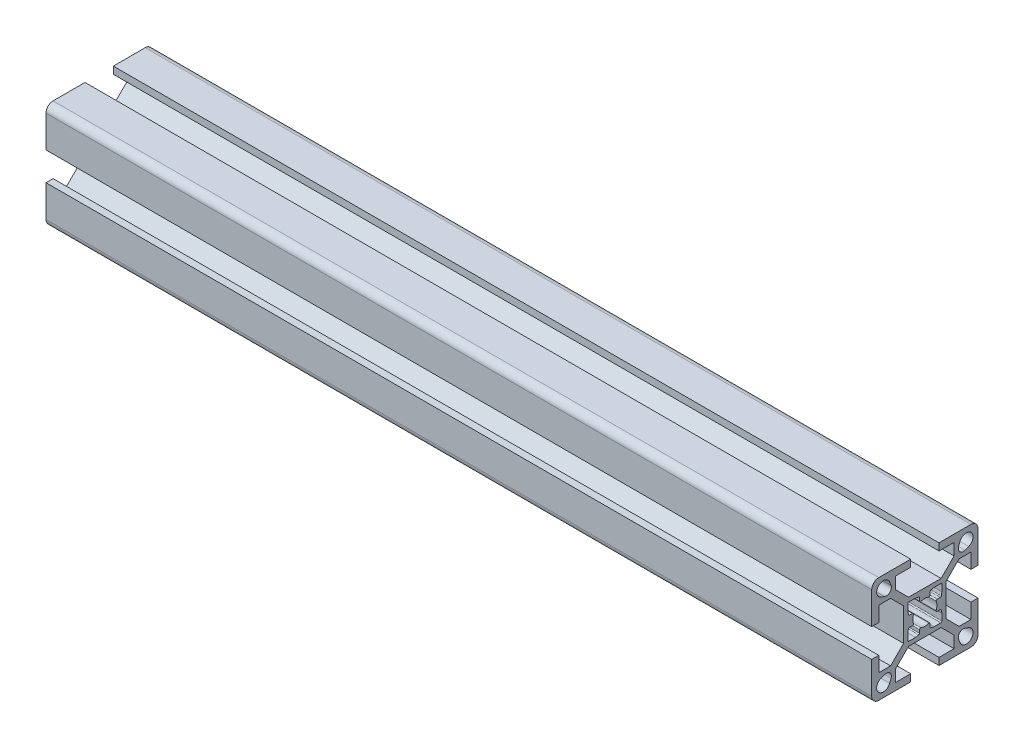
from build123d import *

# Parameters (mm, degrees)
BOSS_EXTRUDE1_DEPTH = 233


with BuildPart() as part:
    # Sketch1 → Boss-Extrude1 (new body)
    with BuildSketch(Plane(origin=(0, 0, 0), x_dir=(0, 0, -1), z_dir=(1, 0, 0))):
        with BuildLine():
            Line((-15, 13), (-15, 4))
            Line((-15, 4), (-13, 4))
            Line((-13, 4), (-13, 8.25))
            Line((-13, 8.25), (-9.664213562, 8.25))
            Line((-9.664213562, 8.25), (-6, 4.585786438))
            Line((-6, 4.585786438), (-6, -4.585786438))
            Line((-6, -4.585786438), (-9.664213562, -8.25))
            Line((-9.664213562, -8.25), (-13, -8.25))
            Line((-13, -8.25), (-13, -4))
            Line((-13, -4), (-15, -4))
            Line((-15, -4), (-15, -13))
            ThreePointArc((-15, -13), (-14.414213562, -14.414213562), (-13, -15))
            Line((-13, -15), (-4, -15))
            Line((-4, -15), (-4, -13))
            Line((-4, -13), (-8.25, -13))
            Line((-8.25, -13), (-8.25, -9.664213562))
            Line((-8.25, -9.664213562), (-4.585786438, -6))
            Line((-4.585786438, -6), (4.585786438, -6))
            Line((4.585786438, -6), (8.25, -9.664213562))
            Line((8.25, -9.664213562), (8.25, -13))
            Line((8.25, -13), (4, -13))
            Line((4, -13), (4, -15))
            Line((4, -15), (13, -15))
            ThreePointArc((13, -15), (14.414213562, -14.414213562), (15, -13))
            Line((15, -13), (15, -4))
            Line((15, -4), (13, -4))
            Line((13, -4), (13, -8.25))
            Line((13, -8.25), (9.664213562, -8.25))
            Line((9.664213562, -8.25), (6, -4.585786438))
            Line((6, -4.585786438), (6, 4.585786438))
            Line((6, 4.585786438), (9.664213562, 8.25))
            Line((9.664213562, 8.25), (13, 8.25))
            Line((13, 8.25), (13, 4))
            Line((13, 4), (15, 4))
            Line((15, 4), (15, 13))
            ThreePointArc((15, 13), (14.414213562, 14.414213562), (13, 15))
            Line((13, 15), (4, 15))
            Line((4, 15), (4, 13))
            Line((4, 13), (8.25, 13))
            Line((8.25, 13), (8.25, 9.664213562))
            Line((8.25, 9.664213562), (4.585786438, 6))
            Line((4.585786438, 6), (-4.585786438, 6))
            Line((-4.585786438, 6), (-8.25, 9.664213562))
            Line((-8.25, 9.664213562), (-8.25, 13))
            Line((-8.25, 13), (-4, 13))
            Line((-4, 13), (-4, 15))
            Line((-4, 15), (-13, 15))
            ThreePointArc((-13, 15), (-14.414213562, 14.414213562), (-15, 13))
        make_face()
        with BuildLine():
            Line((-9.539070071, 11.338915743), (-9.918883282, 12.361530981))
            ThreePointArc((-9.918883282, 12.361530981), (-13.043502884, 13.043502884), (-12.361530981, 9.918883282))
            Line((-12.361530981, 9.918883282), (-11.338915743, 9.539070071))
            ThreePointArc((-11.338915743, 9.539070071), (-9.861522369, 9.861522369), (-9.539070071, 11.338915743))
        make_face(mode=Mode.SUBTRACT)
        with BuildLine():
            Line((9.918883282, 12.361530981), (9.539070071, 11.338915743))
            ThreePointArc((9.539070071, 11.338915743), (9.861522369, 9.861522369), (11.338915743, 9.539070071))
            Line((11.338915743, 9.539070071), (12.361530981, 9.918883282))
            ThreePointArc((12.361530981, 9.918883282), (13.043502884, 13.043502884), (9.918883282, 12.361530981))
        make_face(mode=Mode.SUBTRACT)
        with BuildLine():
            Line((12.361530981, -9.918883282), (11.338915743, -9.539070071))
            ThreePointArc((11.338915743, -9.539070071), (9.861522369, -9.861522369), (9.539070071, -11.338915743))
            Line((9.539070071, -11.338915743), (9.918883282, -12.361530981))
            ThreePointArc((9.918883282, -12.361530981), (13.043502884, -13.043502884), (12.361530981, -9.918883282))
        make_face(mode=Mode.SUBTRACT)
        with BuildLine():
            Line((-11.338915743, -9.539070071), (-12.361530981, -9.918883282))
            ThreePointArc((-12.361530981, -9.918883282), (-13.043502884, -13.043502884), (-9.918883282, -12.361530981))
            Line((-9.918883282, -12.361530981), (-9.539070071, -11.338915743))
            ThreePointArc((-9.539070071, -11.338915743), (-9.861522369, -9.861522369), (-11.338915743, -9.539070071))
        make_face(mode=Mode.SUBTRACT)
        with BuildLine():
            Line((-4.8, -2.644433572), (-4.8, -4.5))
            ThreePointArc((-4.8, -4.5), (-4.712132034, -4.712132034), (-4.5, -4.8))
            Line((-4.5, -4.8), (-2.644433572, -4.8))
            ThreePointArc((-2.644433572, -4.8), (-2.615679847, -4.79861886), (-2.587190874, -4.794488155))
            Line((-2.587190874, -4.794488155), (-1.742757301, -4.630346896))
            ThreePointArc((-1.742757301, -4.630346896), (-1.568512625, -4.526682207), (-1.5, -4.335858741))
            Line((-1.5, -4.335858741), (-1.5, -3.5))
            ThreePointArc((-1.5, -3.5), (-1.374371458, -3.255879959), (-1.102702703, -3.216216216))
            ThreePointArc((-1.102702703, -3.216216216), (0, -3.4), (1.102702703, -3.216216216))
            ThreePointArc((1.102702703, -3.216216216), (1.374371458, -3.255879959), (1.5, -3.5))
            Line((1.5, -3.5), (1.5, -4.335858741))
            ThreePointArc((1.5, -4.335858741), (1.568512625, -4.526682207), (1.742757301, -4.630346896))
            Line((1.742757301, -4.630346896), (2.587190874, -4.794488155))
            ThreePointArc((2.587190874, -4.794488155), (2.615679847, -4.79861886), (2.644433572, -4.8))
            Line((2.644433572, -4.8), (4.5, -4.8))
            ThreePointArc((4.5, -4.8), (4.712132034, -4.712132034), (4.8, -4.5))
            Line((4.8, -4.5), (4.8, -2.644433572))
            ThreePointArc((4.8, -2.644433572), (4.79861886, -2.615679847), (4.794488155, -2.587190874))
            Line((4.794488155, -2.587190874), (4.630346896, -1.742757301))
            ThreePointArc((4.630346896, -1.742757301), (4.526682207, -1.568512625), (4.335858741, -1.5))
            Line((4.335858741, -1.5), (3.5, -1.5))
            ThreePointArc((3.5, -1.5), (3.255879959, -1.374371458), (3.216216216, -1.102702703))
            ThreePointArc((3.216216216, -1.102702703), (3.4, 0), (3.216216216, 1.102702703))
            ThreePointArc((3.216216216, 1.102702703), (3.255879959, 1.374371458), (3.5, 1.5))
            Line((3.5, 1.5), (4.335858741, 1.5))
            ThreePointArc((4.335858741, 1.5), (4.526682207, 1.568512625), (4.630346896, 1.742757301))
            Line((4.630346896, 1.742757301), (4.794488155, 2.587190874))
            ThreePointArc((4.794488155, 2.587190874), (4.79861886, 2.615679847), (4.8, 2.644433572))
            Line((4.8, 2.644433572), (4.8, 4.5))
            ThreePointArc((4.8, 4.5), (4.712132034, 4.712132034), (4.5, 4.8))
            Line((4.5, 4.8), (2.644433572, 4.8))
            ThreePointArc((2.644433572, 4.8), (2.615679847, 4.79861886), (2.587190874, 4.794488155))
            Line((2.587190874, 4.794488155), (1.742757301, 4.630346896))
            ThreePointArc((1.742757301, 4.630346896), (1.568512625, 4.526682207), (1.5, 4.335858741))
            Line((1.5, 4.335858741), (1.5, 3.5))
            ThreePointArc((1.5, 3.5), (1.374371458, 3.255879959), (1.102702703, 3.216216216))
            ThreePointArc((1.102702703, 3.216216216), (0, 3.4), (-1.102702703, 3.216216216))
            ThreePointArc((-1.102702703, 3.216216216), (-1.374371458, 3.255879959), (-1.5, 3.5))
            Line((-1.5, 3.5), (-1.5, 4.335858741))
            ThreePointArc((-1.5, 4.335858741), (-1.568512625, 4.526682207), (-1.742757301, 4.630346896))
            Line((-1.742757301, 4.630346896), (-2.587190874, 4.794488155))
            ThreePointArc((-2.587190874, 4.794488155), (-2.615679847, 4.79861886), (-2.644433572, 4.8))
            Line((-2.644433572, 4.8), (-4.5, 4.8))
            ThreePointArc((-4.5, 4.8), (-4.712132034, 4.712132034), (-4.8, 4.5))
            Line((-4.8, 4.5), (-4.8, 2.644433572))
            ThreePointArc((-4.8, 2.644433572), (-4.79861886, 2.615679847), (-4.794488155, 2.587190874))
            Line((-4.794488155, 2.587190874), (-4.630346896, 1.742757301))
            ThreePointArc((-4.630346896, 1.742757301), (-4.526682207, 1.568512625), (-4.335858741, 1.5))
            Line((-4.335858741, 1.5), (-3.5, 1.5))
            ThreePointArc((-3.5, 1.5), (-3.255879959, 1.374371458), (-3.216216216, 1.102702703))
            ThreePointArc((-3.216216216, 1.102702703), (-3.4, 0), (-3.216216216, -1.102702703))
            ThreePointArc((-3.216216216, -1.102702703), (-3.255879959, -1.374371458), (-3.5, -1.5))
            Line((-3.5, -1.5), (-4.335858741, -1.5))
            ThreePointArc((-4.335858741, -1.5), (-4.526682207, -1.568512625), (-4.630346896, -1.742757301))
            Line((-4.630346896, -1.742757301), (-4.794488155, -2.587190874))
            ThreePointArc((-4.794488155, -2.587190874), (-4.79861886, -2.615679847), (-4.8, -2.644433572))
        make_face(mode=Mode.SUBTRACT)
    extrude(amount=BOSS_EXTRUDE1_DEPTH)


solid = part.part
